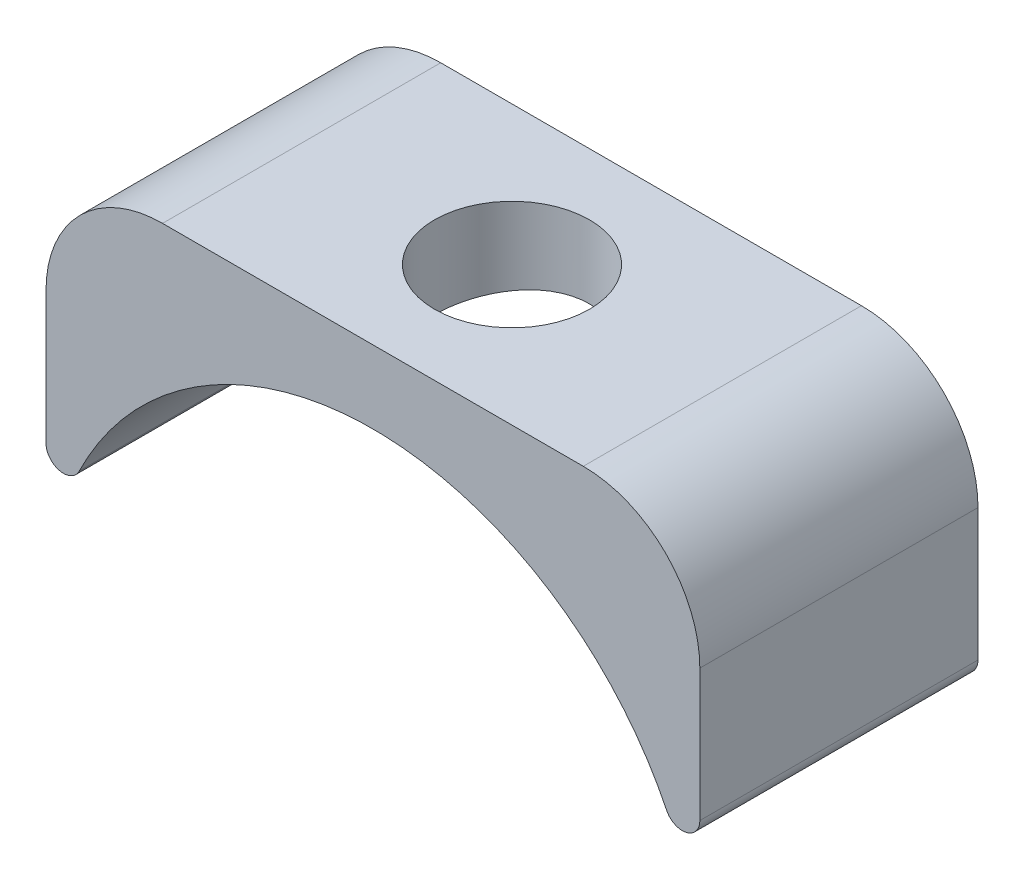
from build123d import *

# Parameters (mm, degrees)
BOSS_EXTRUDE1_DEPTH     = 6.0625
CUT_EXTRUDE1_DEPTH      = 24.31195039566617
CUT_EXTRUDE1_DEPTH_BACK = 24.31195039566617
SKETCH3_R               = 3.3782


with BuildPart() as part:
    # Sketch2 → Boss-Extrude1 (new, symmetric)
    with BuildSketch(Plane.XY):
        with BuildLine():
            Line((-14.25, 6.590447632748479), (-14.25, 12.344999999999999))
            ThreePointArc((-14.25, 12.344999999999999), (-12.762102448427667, 15.937102448427664), (-9.170000000000002, 17.425000000000004))
            Line((-9.170000000000002, 17.425000000000004), (9.36e-15, 17.425))
            Line((9.36e-15, 17.425), (9.169999999999998, 17.424999999999997))
            ThreePointArc((9.169999999999998, 17.424999999999997), (12.762102448427658, 15.937102448427659), (14.25, 12.344999999999999))
            Line((14.25, 12.344999999999999), (14.249999999999998, 6.5904476327484804))
            ThreePointArc((14.249999999999998, 6.5904476327484804), (13.659677420444995, 5.848038807835043), (12.80335731414868, 6.255920514699297))
            ThreePointArc((12.80335731414868, 6.255920514699297), (7.547040236593919, 12.087377038350068), (9.54e-15, 14.25))
            ThreePointArc((9.54e-15, 14.25), (-7.547040236593908, 12.087377038350072), (-12.803357314148682, 6.255920514699296))
            ThreePointArc((-12.803357314148682, 6.255920514699296), (-13.659677420444993, 5.848038807835042), (-14.25, 6.590447632748479))
        make_face()
    extrude(amount=BOSS_EXTRUDE1_DEPTH, both=True)

    # Sketch3 → Cut-Extrude1 (cut, two sides: drawn at the far end of the back side and taken through both)
    with BuildSketch(Plane(origin=(0, 0, 0), x_dir=(1, 0, 0), z_dir=(0, 1, 0)).offset(-CUT_EXTRUDE1_DEPTH_BACK)):
        with Locations(Location((0, 0, 0), (0, 0, 90))):
            Circle(SKETCH3_R)
    extrude(amount=CUT_EXTRUDE1_DEPTH + CUT_EXTRUDE1_DEPTH_BACK, mode=Mode.SUBTRACT)


solid = part.part
